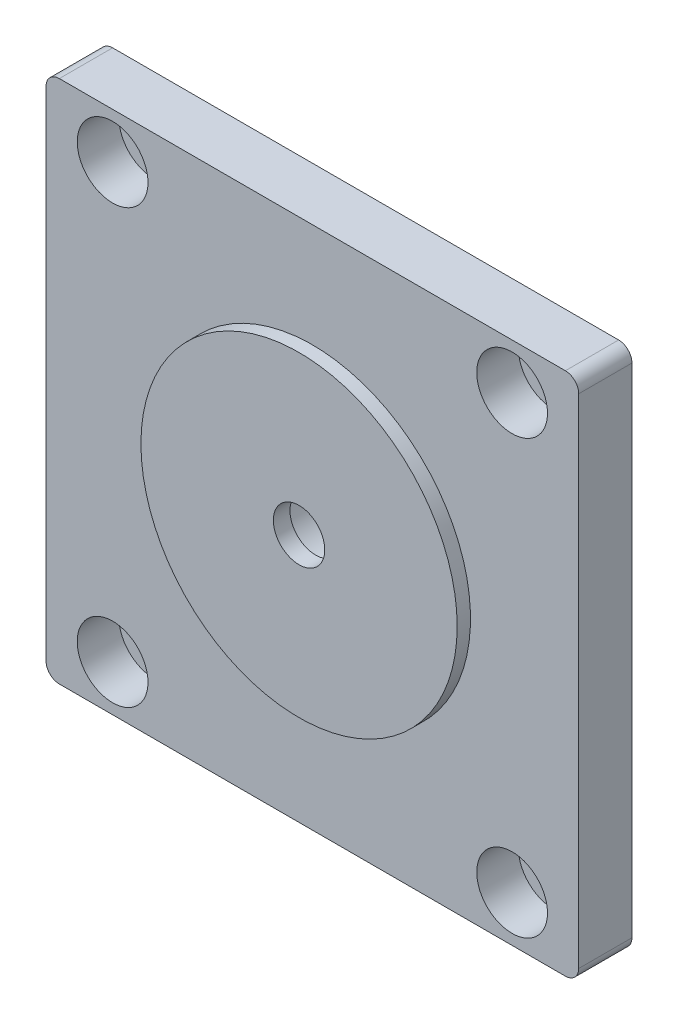
from build123d import *

# Parameters (mm, degrees)
SKETCH1_W                                         = 101.6
SKETCH1_H                                         = 100.0125
BOSS_EXTRUDE1_DEPTH                               = 10.16
CBORE_FOR_5_16_SOCKET_HEAD_CAP_SCREW1_D           = 8.2042
CBORE_FOR_5_16_SOCKET_HEAD_CAP_SCREW1_CBORE_D     = 13.49502
CBORE_FOR_5_16_SOCKET_HEAD_CAP_SCREW1_CBORE_DEPTH = 7.9375
SKETCH4_R                                         = 30.1625
BOSS_EXTRUDE2_DEPTH                               = 2.54
CBORE_FOR_3_8_SOCKET_HEAD_CAP_SCREW1_D            = 9.8044
CBORE_FOR_3_8_SOCKET_HEAD_CAP_SCREW1_CBORE_D      = 15.875
CBORE_FOR_3_8_SOCKET_HEAD_CAP_SCREW1_CBORE_DEPTH  = 9.525
FILLET1_R                                         = 2.54


with BuildPart() as part:
    # Sketch1 → Boss-Extrude1 (new body)
    with BuildSketch(Plane.XY):
        with Locations((50.8, 50.00625)):
            Rectangle(SKETCH1_W, SKETCH1_H)
    extrude(amount=BOSS_EXTRUDE1_DEPTH)

    # CBORE for 5/16 Socket Head Cap Screw1 (through all)
    with Locations(Plane.XY.offset(10.16)):
        with Locations((88.9, 8.73125), (88.9, 91.28125), (12.7, 8.73125), (12.7, 91.28125)):
            CounterBoreHole(CBORE_FOR_5_16_SOCKET_HEAD_CAP_SCREW1_D / 2, CBORE_FOR_5_16_SOCKET_HEAD_CAP_SCREW1_CBORE_D / 2, CBORE_FOR_5_16_SOCKET_HEAD_CAP_SCREW1_CBORE_DEPTH)

    # Sketch4 → Boss-Extrude2 (add)
    with BuildSketch(Plane.XY.offset(10.16)):
        with Locations(Location((50.8, 50.00625, 0), (0, 0, 180))):
            Circle(SKETCH4_R)
    extrude(amount=BOSS_EXTRUDE2_DEPTH)

    # CBORE for 3/8 Socket Head Cap Screw1 (through all)
    with Locations(Plane(origin=(0, 0, 0), x_dir=(-1, 0, 0), z_dir=(0, 0, -1))):
        with Locations((-50.8, 50.00625)):
            CounterBoreHole(CBORE_FOR_3_8_SOCKET_HEAD_CAP_SCREW1_D / 2, CBORE_FOR_3_8_SOCKET_HEAD_CAP_SCREW1_CBORE_D / 2, CBORE_FOR_3_8_SOCKET_HEAD_CAP_SCREW1_CBORE_DEPTH)

    # Fillet1
    fillet1_edges = [part.edges().sort_by_distance(p)[0] for p in [
        (0, 100.0125, 5.08),
        (101.6, 100.0125, 5.08),
        (101.6, 0, 5.08),
        (0, 0, 5.08),
    ]]
    fillet(fillet1_edges, radius=FILLET1_R)


solid = part.part
